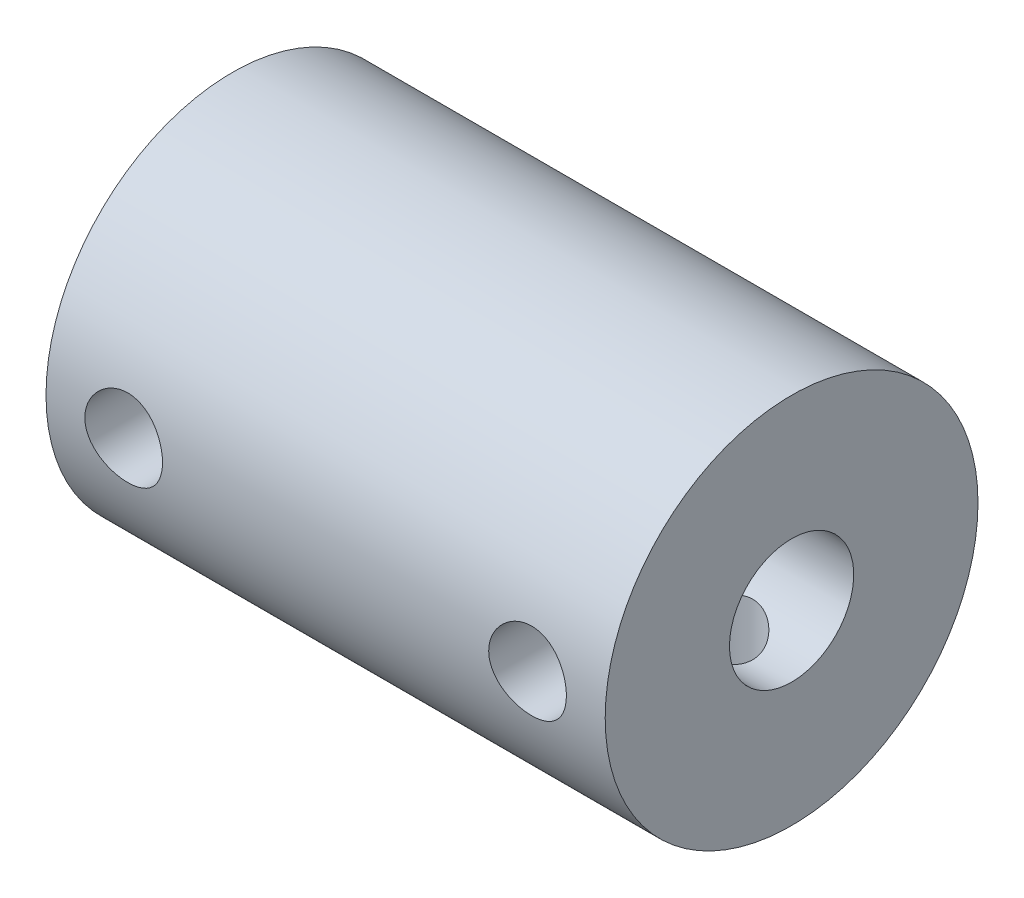
from build123d import *

# Parameters (mm, degrees)
SKETCH2_W              = 18
SKETCH2_H              = 4
M3_TAPPED_HOLE1_REACH  = 24.45
M3_TAPPED_HOLE1_BORE_R = 1.25
M3_TAPPED_HOLE2_REACH  = 24.45
M3_TAPPED_HOLE2_BORE_R = 1.25


with BuildPart() as part:
    # Sketch2 → Revolve1 (revolve)
    with BuildSketch(Plane.XY, mode=Mode.PRIVATE) as revolve1_sk:
        with Locations((9, 4)):
            Rectangle(SKETCH2_W, SKETCH2_H)
    revolve(revolve1_sk.sketch.rotate(Axis((0, 0, 0), (1, 0, 0)), 90), axis=Axis((0, 0, 0), (1, 0, 0)))

    # M3 Tapped Hole1 bore → M3 Tapped Hole1 (cut, up to next)
    with BuildSketch(Plane(origin=(0, -6, 0), x_dir=(-1, 0, 0), z_dir=(0, -1, 0)), mode=Mode.PRIVATE) as m3_tapped_hole1_sk1:
        with Locations((-15.5, 0)):
            Circle(M3_TAPPED_HOLE1_BORE_R)
    m3_tapped_hole1_tool1 = extrude(m3_tapped_hole1_sk1.sketch, amount=-M3_TAPPED_HOLE1_REACH, mode=Mode.PRIVATE) & part.part
    # M3 Tapped Hole1 bore → M3 Tapped Hole1 (cut, up to next)
    with BuildSketch(Plane(origin=(0, -6, 0), x_dir=(-1, 0, 0), z_dir=(0, -1, 0)), mode=Mode.PRIVATE) as m3_tapped_hole1_sk2:
        with Locations((-2.5, 0)):
            Circle(M3_TAPPED_HOLE1_BORE_R)
    m3_tapped_hole1_tool2 = extrude(m3_tapped_hole1_sk2.sketch, amount=-M3_TAPPED_HOLE1_REACH, mode=Mode.PRIVATE) & part.part
    add(m3_tapped_hole1_tool1.solids().sort_by_distance((15.5, -6, 0))[0], mode=Mode.SUBTRACT)
    add(m3_tapped_hole1_tool2.solids().sort_by_distance((2.5, -6, 0))[0], mode=Mode.SUBTRACT)

    # M3 Tapped Hole2 bore → M3 Tapped Hole2 (cut, up to next)
    with BuildSketch(Plane.XY.offset(6), mode=Mode.PRIVATE) as m3_tapped_hole2_sk1:
        with Locations((2.5, 0)):
            Circle(M3_TAPPED_HOLE2_BORE_R)
    m3_tapped_hole2_tool1 = extrude(m3_tapped_hole2_sk1.sketch, amount=-M3_TAPPED_HOLE2_REACH, mode=Mode.PRIVATE) & part.part
    # M3 Tapped Hole2 bore → M3 Tapped Hole2 (cut, up to next)
    with BuildSketch(Plane.XY.offset(6), mode=Mode.PRIVATE) as m3_tapped_hole2_sk2:
        with Locations((15.5, 0)):
            Circle(M3_TAPPED_HOLE2_BORE_R)
    m3_tapped_hole2_tool2 = extrude(m3_tapped_hole2_sk2.sketch, amount=-M3_TAPPED_HOLE2_REACH, mode=Mode.PRIVATE) & part.part
    add(m3_tapped_hole2_tool1.solids().sort_by_distance((2.5, 0, 6))[0], mode=Mode.SUBTRACT)
    add(m3_tapped_hole2_tool2.solids().sort_by_distance((15.5, 0, 6))[0], mode=Mode.SUBTRACT)


solid = part.part
